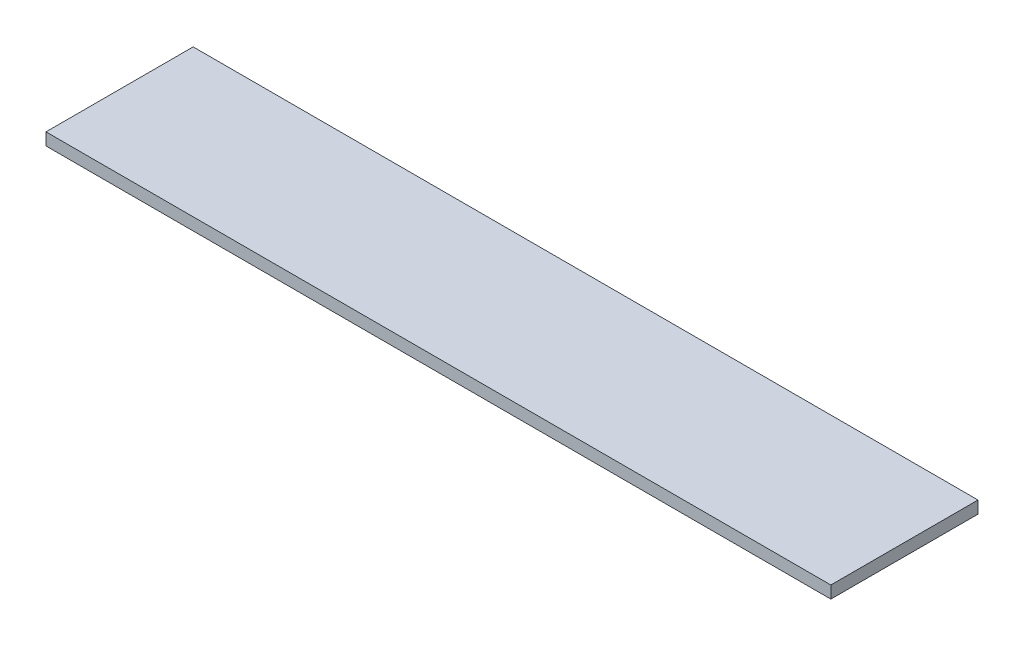
from build123d import *

# Parameters (mm, degrees)
SKETCH_1_W      = 320
SKETCH_1_H      = 60
EXTRUDE_1_DEPTH = 5


with BuildPart() as part:
    # 草图1 → 凸台-拉伸1 (new body)
    with BuildSketch(Plane(origin=(0, 0, 0), x_dir=(1, 0, 0), z_dir=(0, 1, 0))):
        with Locations((160, -30)):
            Rectangle(SKETCH_1_W, SKETCH_1_H)
    extrude(amount=EXTRUDE_1_DEPTH)


solid = part.part
